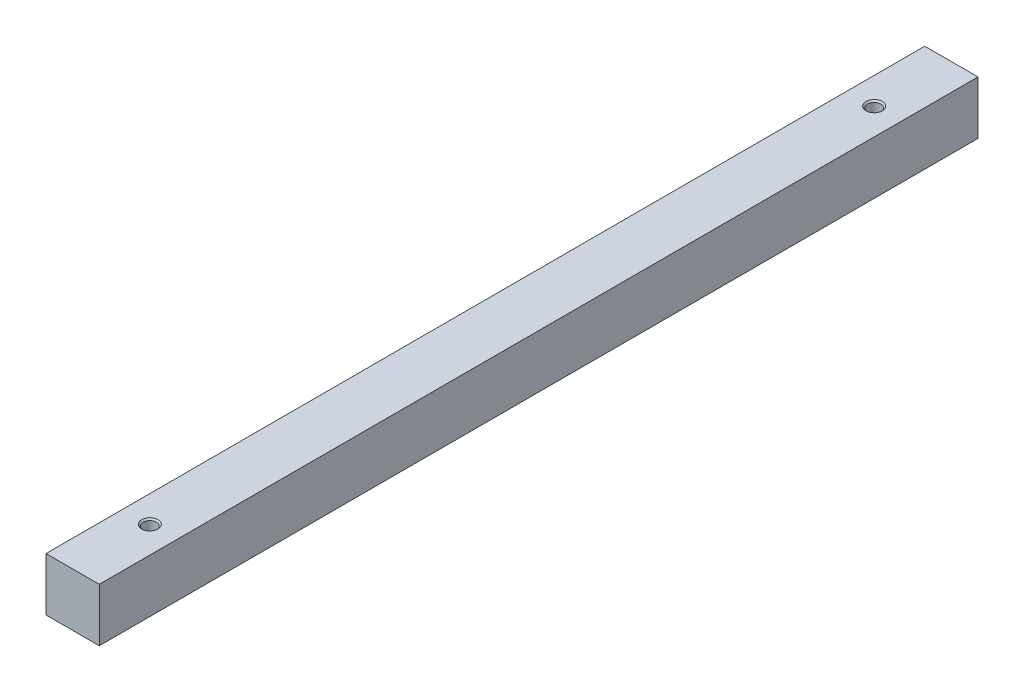
from build123d import *

# Parameters (mm, degrees)
ESQUISSE1_W                     = 10
ESQUISSE1_H                     = 10
BOSS_EXTRU_1_DEPTH              = 82.5
TROU_TARAUD_M3X0_52_D           = 2.5
TROU_TARAUD_M3X0_52_CSINK_D     = 3.05
TROU_TARAUD_M3X0_52_CSINK_ANGLE = 90


with BuildPart() as part:
    # Esquisse1 → Boss.-Extru.1 (new, symmetric)
    with BuildSketch(Plane.XY):
        Rectangle(ESQUISSE1_W, ESQUISSE1_H)
    extrude(amount=BOSS_EXTRU_1_DEPTH, both=True)

    # Trou taraudé M3x0.52 (through all)
    with Locations(Plane(origin=(0, 5, 0), x_dir=(1, 0, 0), z_dir=(0, 1, 0))):
        with Locations((0, 68), (0, -68)):
            CounterSinkHole(TROU_TARAUD_M3X0_52_D / 2, TROU_TARAUD_M3X0_52_CSINK_D / 2, counter_sink_angle=TROU_TARAUD_M3X0_52_CSINK_ANGLE)


solid = part.part
